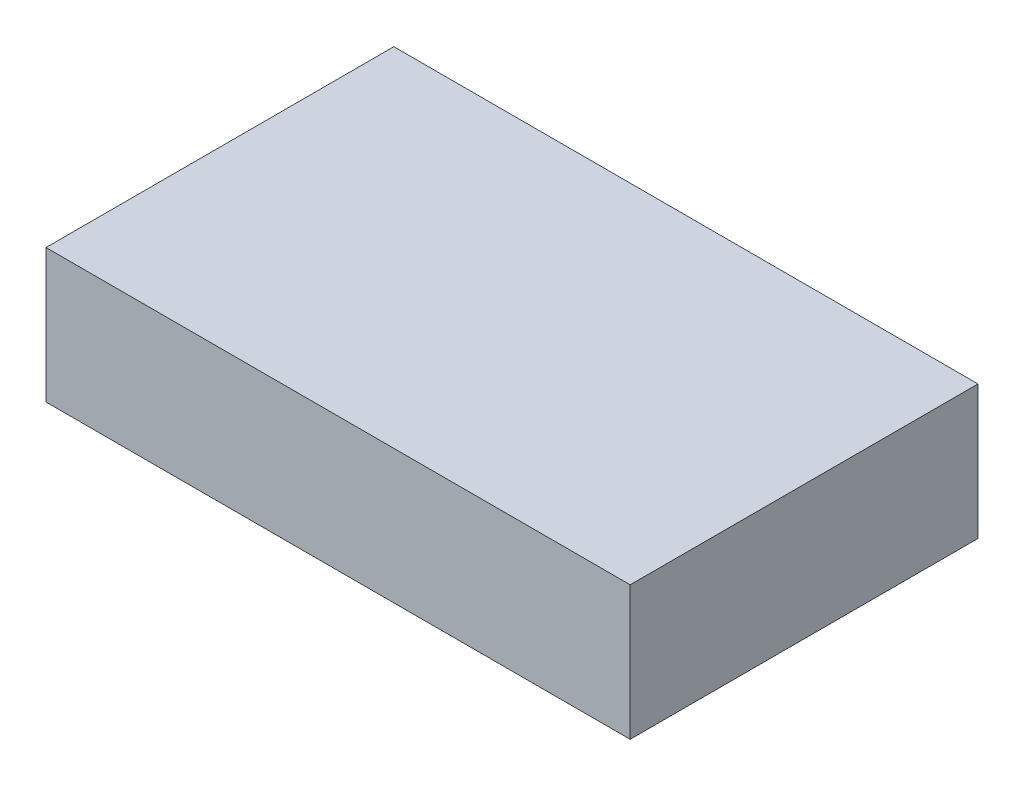
from build123d import *

# Parameters (mm, degrees)
SKETCH1_W           = 110
SKETCH1_H           = 65.5
BOSS_EXTRUDE1_DEPTH = 25.2


with BuildPart() as part:
    # Sketch1 → Boss-Extrude1 (new body)
    with BuildSketch(Plane(origin=(0, 0, 0), x_dir=(1, 0, 0), z_dir=(0, 1, 0))):
        Rectangle(SKETCH1_W, SKETCH1_H)
    extrude(amount=BOSS_EXTRUDE1_DEPTH)


solid = part.part
